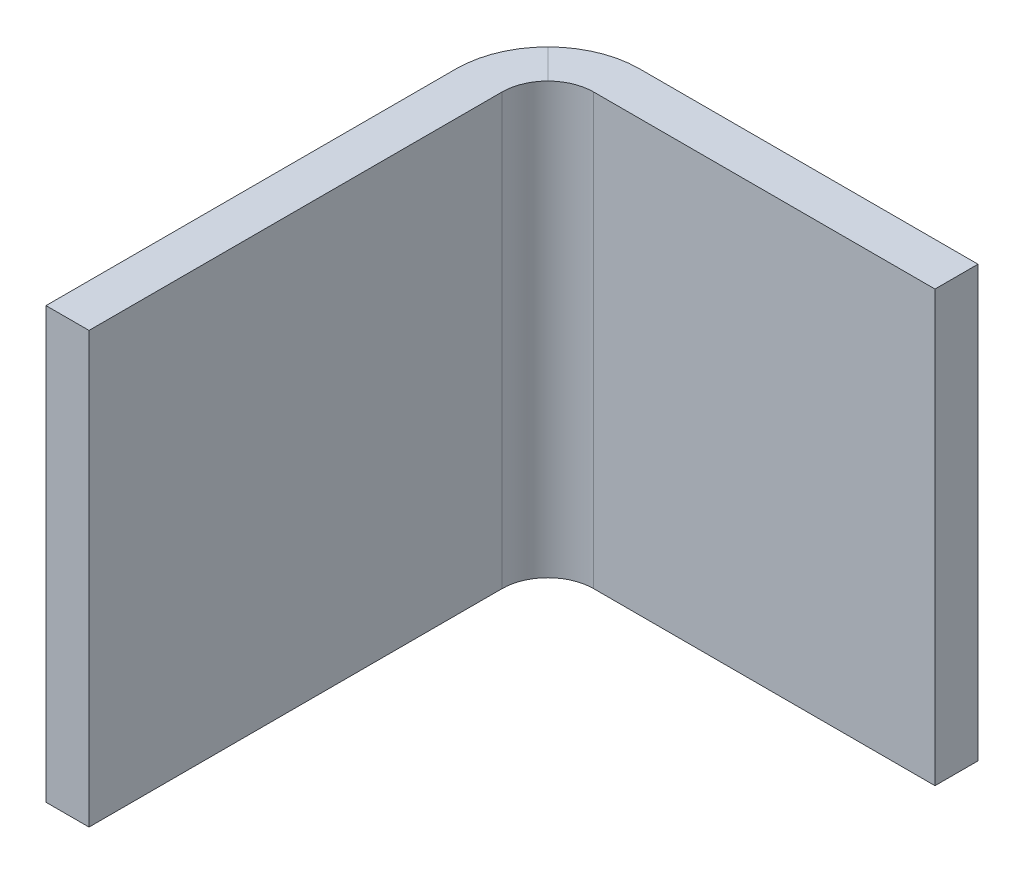
from build123d import *

# Parameters (mm, degrees)
SKETCH3_W = 3
SKETCH3_H = 30
FILLET1_R = 3.2
FILLET2_R = 6.4


with BuildPart() as part:
    # Sweep1: sweep along a path in Sketch4
    with BuildLine(Plane(origin=(0, 0, 0), x_dir=(1, 0, 0), z_dir=(0, 1, 0))) as sweep1_path:
        Line((0, 0), (0, 35))
        Line((0, 35), (30, 35))
    # Sketch3 → Sweep1 (sweep)
    with BuildSketch(Plane.XY):
        with Locations((1.5, 0)):
            Rectangle(SKETCH3_W, SKETCH3_H)
    sweep(path=sweep1_path.line, transition=Transition.RIGHT)

    # Fillet1
    fillet1_edges = [part.edges().sort_by_distance(p)[0] for p in [
        (3, 0, -32),
    ]]
    fillet(fillet1_edges, radius=FILLET1_R)

    # Fillet2
    fillet2_edges = [part.edges().sort_by_distance(p)[0] for p in [
        (0, 0, -35),
    ]]
    fillet(fillet2_edges, radius=FILLET2_R)


solid = part.part
